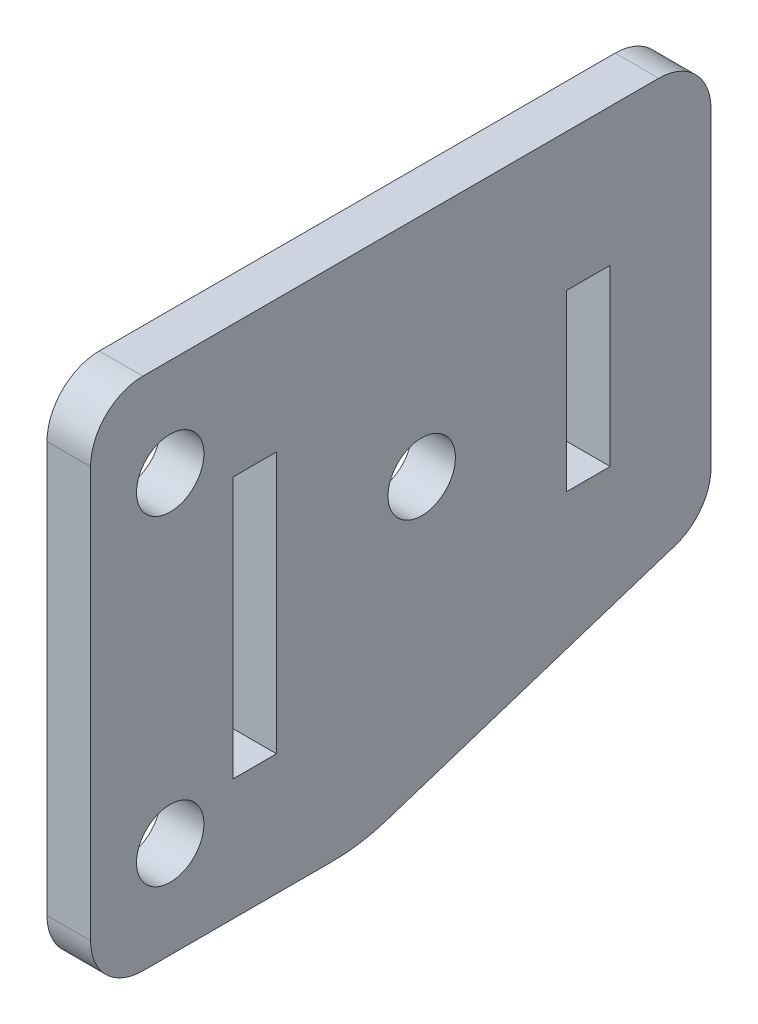
from build123d import *

# Parameters (mm, degrees)
BOSS_EXTRUDE1_DEPTH              = 3.175
F_10_0_1935_DIAMETER_HOLE1_D     = 4.9149
F_10_0_1935_DIAMETER_HOLE1_DEPTH = 11.176
F_10_0_1935_DIAMETER_HOLE1_TIP   = 1.476584928
SKETCH6_W                        = 3.175
SKETCH6_H                        = 19.05
SKETCH6_H_2                      = 12.7
CUT_EXTRUDE1_DEPTH               = 63.157515949
FILLET1_R                        = 3.81


with BuildPart() as part:
    # Sketch1 → Boss-Extrude1 (new body)
    with BuildSketch(Plane(origin=(0, 0, 0), x_dir=(0, 0, -1), z_dir=(1, 0, 0))):
        with BuildLine():
            Line((-11.43, 25.4), (-56.642, 25.4))
            Line((-56.642, 25.4), (-56.642, -12.13104))
            Line((-56.642, -12.13104), (-39.203469383, -12.13104))
            Line((-39.203469383, -12.13104), (-38.998073701, -12.13104))
            ThreePointArc((-38.998073701, -12.13104), (-37.012948259, -11.974934012), (-35.076624386, -11.510453697))
            Line((-35.076624386, -11.510453697), (-11.43, -3.833836163))
            Line((-11.43, -3.833836163), (-11.43, 25.4))
        make_face()
    extrude(amount=-BOSS_EXTRUDE1_DEPTH)

    # #10 (0.1935) Diameter Hole1
    with Locations(Plane(origin=(0, 0, 0), x_dir=(0, 0, -1), z_dir=(1, 0, 0))):
        with Locations((-50.8381, -5.08), (-50.8381, 18.288), (-32.512, 8.89)):
            Hole(F_10_0_1935_DIAMETER_HOLE1_D / 2, depth=F_10_0_1935_DIAMETER_HOLE1_DEPTH)
            with Locations((0, 0, -(F_10_0_1935_DIAMETER_HOLE1_DEPTH + F_10_0_1935_DIAMETER_HOLE1_TIP / 2))):  # 118° drill point
                Cone(0, F_10_0_1935_DIAMETER_HOLE1_D / 2, F_10_0_1935_DIAMETER_HOLE1_TIP, mode=Mode.SUBTRACT)

    # Sketch6 → Cut-Extrude1 (cut, through all)
    with BuildSketch(Plane.ZY.offset(3.175)):
        with Locations((44.6786, 6.223)):
            Rectangle(SKETCH6_W, SKETCH6_H)
        with Locations((20.364644497, 9.020993871)):
            Rectangle(SKETCH6_W, SKETCH6_H_2)
    extrude(amount=-CUT_EXTRUDE1_DEPTH, mode=Mode.SUBTRACT)

    # Fillet1
    fillet1_edges = [part.edges().sort_by_distance(p)[0] for p in [
        (-1.5875, -12.13104, 56.642),
        (-1.5875, 25.4, 56.642),
        (-1.5875, 25.4, 11.43),
        (-1.5875, -3.833836163, 11.43),
    ]]
    fillet(fillet1_edges, radius=FILLET1_R)


solid = part.part
